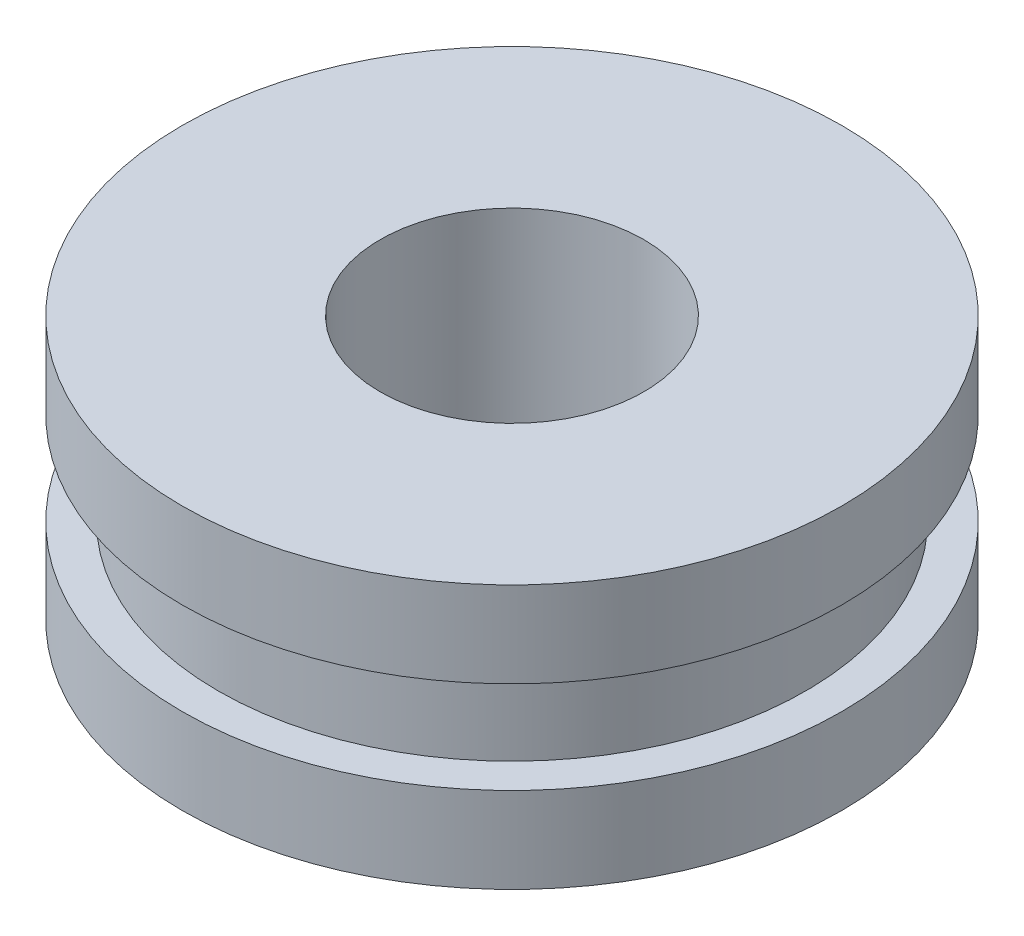
from build123d import *

# Parameters (mm, degrees)
SKETCH1_R           = 5
SKETCH1_R_2         = 2
BOSS_EXTRUDE1_DEPTH = 1.3
SKETCH2_R           = 4.456309589
SKETCH2_R_2         = 2
BOSS_EXTRUDE2_DEPTH = 1.4
LPATTERN2_COUNT     = 2
LPATTERN2_PITCH     = 2.7


with BuildPart() as part:
    # Sketch1 → Boss-Extrude1 (new body)
    with BuildSketch(Plane(origin=(0, 0, 0), x_dir=(1, 0, 0), z_dir=(0, 1, 0))):
        with Locations(Location((0, 0, 0), (0, 0, 270))):
            Circle(SKETCH1_R)
        with Locations(Location((0, 0, 0), (0, 0, 270))):
            Circle(SKETCH1_R_2, mode=Mode.SUBTRACT)
    boss_extrude1 = extrude(amount=BOSS_EXTRUDE1_DEPTH)

    # Sketch2 → Boss-Extrude2 (add)
    with BuildSketch(Plane(origin=(0, 1.3, 0), x_dir=(1, 0, 0), z_dir=(0, 1, 0))):
        with Locations(Location((0, 0, 0), (0, 0, 270))):
            Circle(SKETCH2_R)
        with Locations(Location((0, 0, 0), (0, 0, 270))):
            Circle(SKETCH2_R_2, mode=Mode.SUBTRACT)
    extrude(amount=BOSS_EXTRUDE2_DEPTH)

    # LPattern2: Boss-Extrude1 ×2
    with Locations(*[(0, i * LPATTERN2_PITCH, 0) for i in range(1, LPATTERN2_COUNT)]):
        add(boss_extrude1)


solid = part.part
